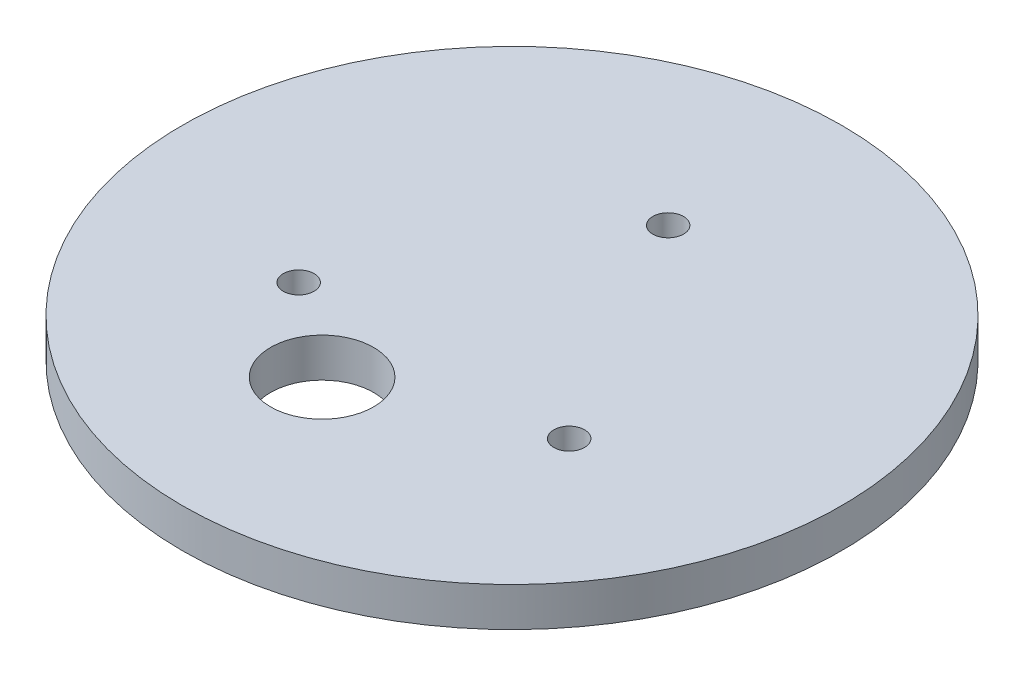
from build123d import *

# Parameters (mm, degrees)
SKETCH2_R           = 26.799999994
BOSS_EXTRUDE1_DEPTH = 3.175
SKETCH3_R           = 1.25
CUT_EXTRUDE1_DEPTH  = 3.175
SKETCH4_R           = 4.191
CUT_EXTRUDE2_DEPTH  = 7.62


with BuildPart() as part:
    # Sketch2 → Boss-Extrude1 (new body)
    with BuildSketch(Plane(origin=(0, 0, 0), x_dir=(1, 0, 0), z_dir=(0, 1, 0))):
        Circle(SKETCH2_R)
    extrude(amount=BOSS_EXTRUDE1_DEPTH)

    # Sketch3 → Cut-Extrude1 (cut)
    with BuildSketch(Plane(origin=(0, 3.175, 0), x_dir=(1, 0, 0), z_dir=(0, 1, 0))):
        with Locations((0, 12.7)):
            Circle(SKETCH3_R)
        with Locations((-10.998522628, -6.35)):
            Circle(SKETCH3_R)
        with Locations((10.998522628, -6.35)):
            Circle(SKETCH3_R)
    extrude(amount=-CUT_EXTRUDE1_DEPTH, mode=Mode.SUBTRACT)

    # Sketch4 → Cut-Extrude2 (cut)
    with BuildSketch(Plane(origin=(0, 3.175, 0), x_dir=(1, 0, 0), z_dir=(0, 1, 0))):
        with Locations((-3.378522628, -12.065)):
            Circle(SKETCH4_R)
    extrude(amount=-CUT_EXTRUDE2_DEPTH, mode=Mode.SUBTRACT)


solid = part.part
